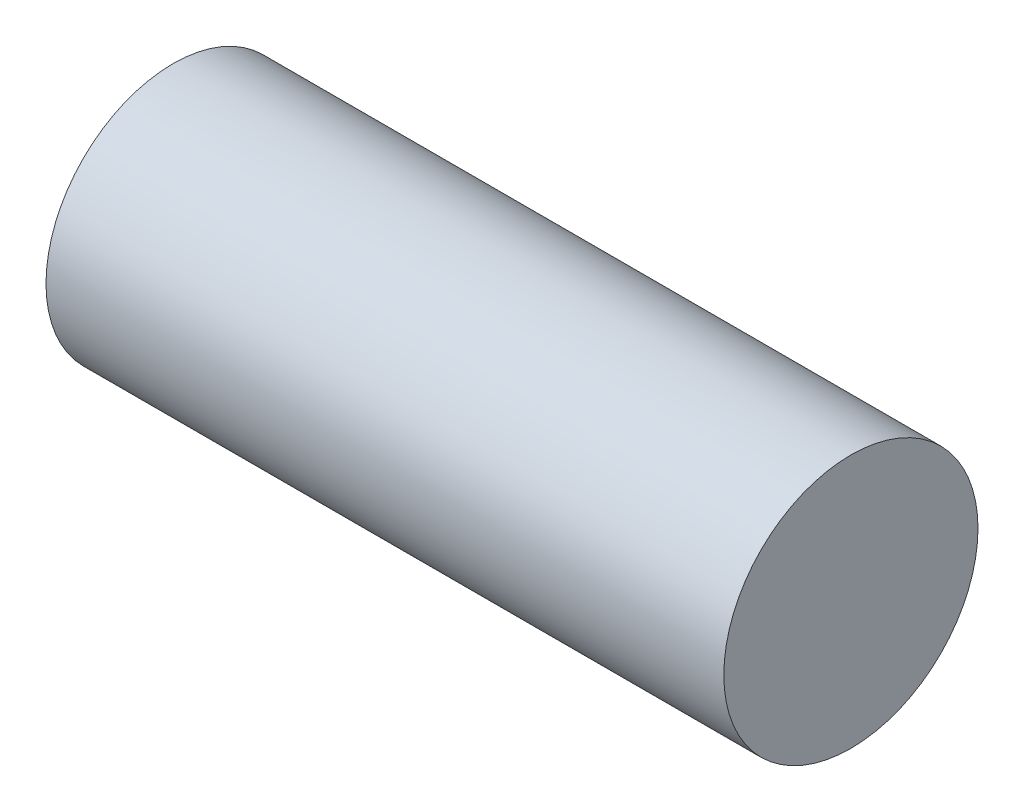
from build123d import *

# Parameters (mm, degrees)
SKETCH1_R           = 7.5
BOSS_EXTRUDE1_DEPTH = 40


with BuildPart() as part:
    # Sketch1 → Boss-Extrude1 (new body)
    with BuildSketch(Plane(origin=(0, 0, 0), x_dir=(0, 0, -1), z_dir=(1, 0, 0))):
        Circle(SKETCH1_R)
    extrude(amount=BOSS_EXTRUDE1_DEPTH)


solid = part.part
